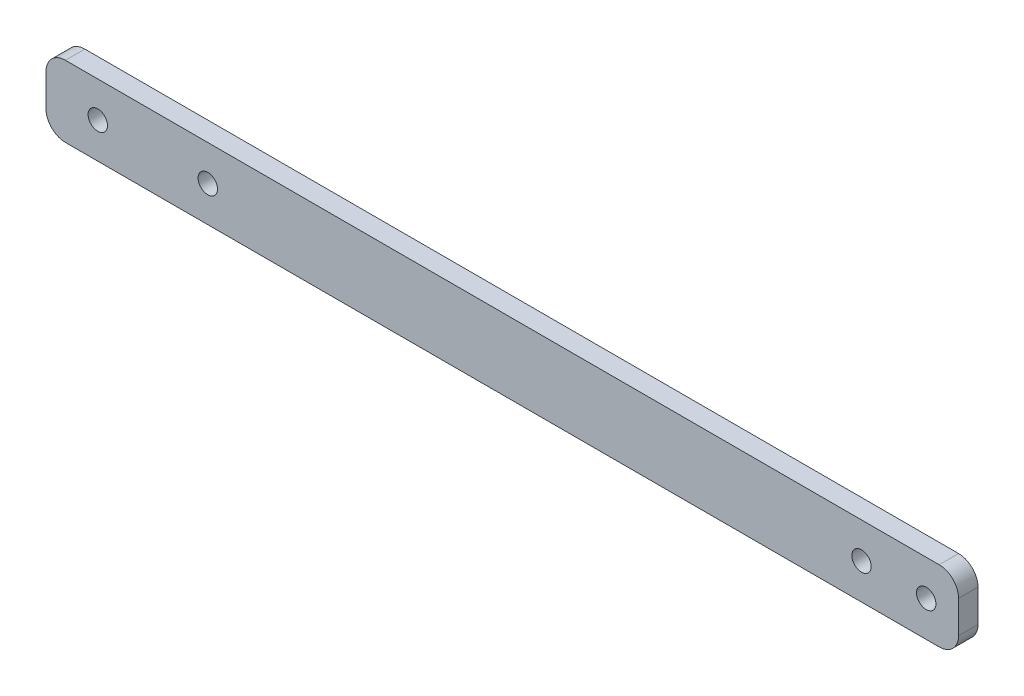
from build123d import *

# Parameters (mm, degrees)
SKETCH_1_W      = 141
SKETCH_1_H      = 11
SKETCH_1_R      = 1.5
EXTRUDE_1_DEPTH = 3
FILLET_1_R      = 3


with BuildPart() as part:
    # 草图1 → 凸台-拉伸1 (new body)
    with BuildSketch(Plane.XY):
        with Locations((70.5, -5.5)):
            Rectangle(SKETCH_1_W, SKETCH_1_H)
        with Locations((126, -5.5)):
            Circle(SKETCH_1_R, mode=Mode.SUBTRACT)
        with Locations((136, -5.5)):
            Circle(SKETCH_1_R, mode=Mode.SUBTRACT)
        with Locations((8, -5.5)):
            Circle(SKETCH_1_R, mode=Mode.SUBTRACT)
        with Locations((25, -5.5)):
            Circle(SKETCH_1_R, mode=Mode.SUBTRACT)
    extrude(amount=EXTRUDE_1_DEPTH)

    # 圆角1
    fillet_1_edges = [part.edges().sort_by_distance(p)[0] for p in [
        (0, 0, 1.5),
        (141, 0, 1.5),
        (141, -11, 1.5),
        (0, -11, 1.5),
    ]]
    fillet(fillet_1_edges, radius=FILLET_1_R)


solid = part.part
